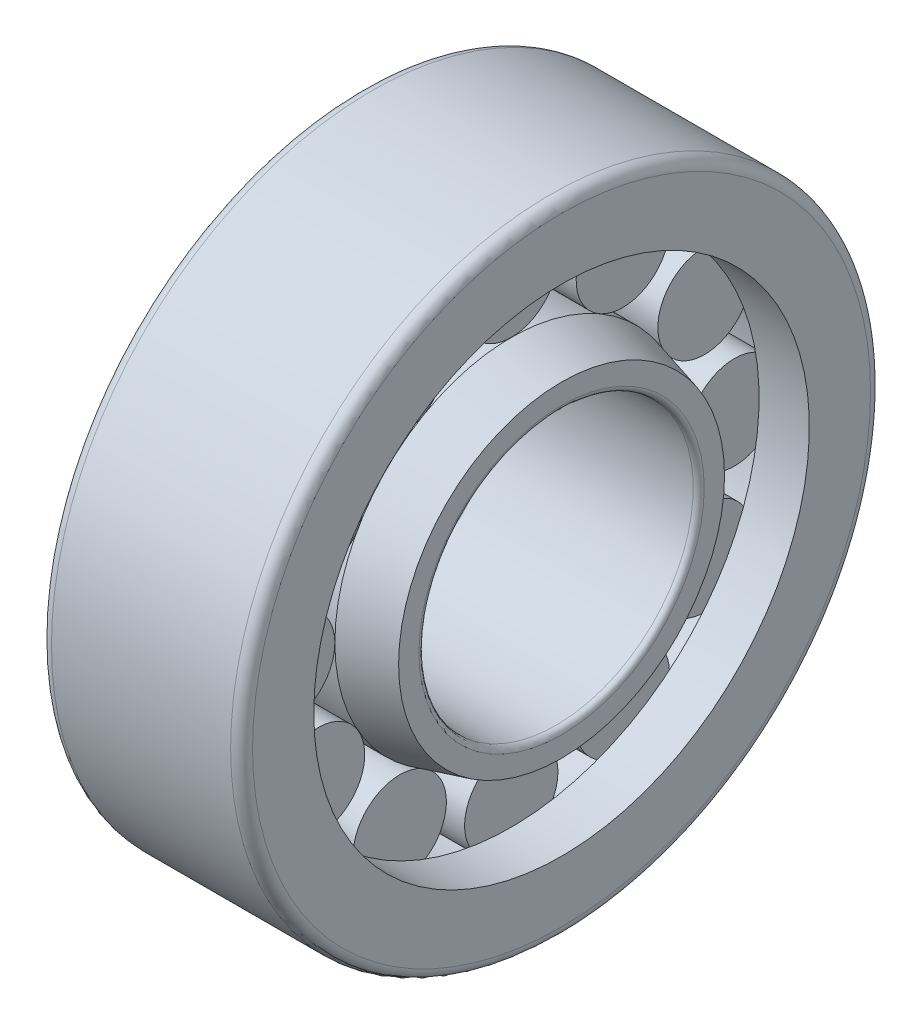
from build123d import *

# Parameters (mm, degrees)
SKETCH_3_W               = 5.5
SKETCH_3_H               = 2.55125
PATTERN_CIRCULAR_1_COUNT = 12


with BuildPart() as part:
    # 草图2 → Revolve 600 (revolve)
    with BuildSketch(Plane.XY):
        with BuildLine():
            Line((2.75, 9.65), (8.25, 9.65))
            Line((8.25, 9.65), (11, 8.913139721))
            Line((11, 8.913139721), (11, 7.8))
            ThreePointArc((11, 7.8), (10.912132034, 7.587867966), (10.7, 7.5))
            Line((10.7, 7.5), (0.3, 7.5))
            ThreePointArc((0.3, 7.5), (0.087867966, 7.587867966), (0, 7.8))
            Line((0, 7.8), (0, 10.25))
            Line((0, 10.25), (2.75, 10.25))
            Line((2.75, 10.25), (2.75, 9.65))
        make_face()
    revolve(axis=Axis((-10.080094127, 0, 0), (1, 0, 0)))


with BuildPart() as body_2:
    # 草图4 → 凸台-旋转2 (revolve)
    with BuildSketch(Plane.XY):
        with BuildLine():
            Line((8.25, 13.5525), (11, 13.5525))
            Line((11, 13.5525), (11, 16.9))
            ThreePointArc((11, 16.9), (10.824264069, 17.324264069), (10.4, 17.5))
            Line((10.4, 17.5), (0.6, 17.5))
            ThreePointArc((0.6, 17.5), (0.175735931, 17.324264069), (0, 16.9))
            Line((0, 16.9), (0, 13.5525))
            Line((0, 13.5525), (2.75, 13.5525))
            Line((2.75, 13.5525), (2.75, 14.7525))
            Line((2.75, 14.7525), (8.25, 14.7525))
            Line((8.25, 14.7525), (8.25, 13.5525))
        make_face()
    revolve(axis=Axis((0, 0, 0), (1, 0, 0)))


with BuildPart() as body_3:
    # 草图3 → 凸台-旋转1 (revolve)
    with BuildSketch(Plane.XY):
        with Locations((5.5, 13.476875)):
            Rectangle(SKETCH_3_W, SKETCH_3_H)
    revolve(axis=Axis((2.75, 12.20125, 0), (1, 0, 0)))


with BuildPart() as pattern_circular_1_1:
    # 阵列(圆周)1: pattern copy
    add(body_3.part.rotate(Axis((-80.9, 0, 0), (1, 0, 0)), 1 * 360 / PATTERN_CIRCULAR_1_COUNT))


with BuildPart() as pattern_circular_1_2:
    # 阵列(圆周)1: pattern copy
    add(body_3.part.rotate(Axis((-80.9, 0, 0), (1, 0, 0)), 2 * 360 / PATTERN_CIRCULAR_1_COUNT))


with BuildPart() as pattern_circular_1_3:
    # 阵列(圆周)1: pattern copy
    add(body_3.part.rotate(Axis((-80.9, 0, 0), (1, 0, 0)), 3 * 360 / PATTERN_CIRCULAR_1_COUNT))


with BuildPart() as pattern_circular_1_4:
    # 阵列(圆周)1: pattern copy
    add(body_3.part.rotate(Axis((-80.9, 0, 0), (1, 0, 0)), 4 * 360 / PATTERN_CIRCULAR_1_COUNT))


with BuildPart() as pattern_circular_1_5:
    # 阵列(圆周)1: pattern copy
    add(body_3.part.rotate(Axis((-80.9, 0, 0), (1, 0, 0)), 5 * 360 / PATTERN_CIRCULAR_1_COUNT))


with BuildPart() as pattern_circular_1_6:
    # 阵列(圆周)1: pattern copy
    add(body_3.part.rotate(Axis((-80.9, 0, 0), (1, 0, 0)), 6 * 360 / PATTERN_CIRCULAR_1_COUNT))


with BuildPart() as pattern_circular_1_7:
    # 阵列(圆周)1: pattern copy
    add(body_3.part.rotate(Axis((-80.9, 0, 0), (1, 0, 0)), 7 * 360 / PATTERN_CIRCULAR_1_COUNT))


with BuildPart() as pattern_circular_1_8:
    # 阵列(圆周)1: pattern copy
    add(body_3.part.rotate(Axis((-80.9, 0, 0), (1, 0, 0)), 8 * 360 / PATTERN_CIRCULAR_1_COUNT))


with BuildPart() as pattern_circular_1_9:
    # 阵列(圆周)1: pattern copy
    add(body_3.part.rotate(Axis((-80.9, 0, 0), (1, 0, 0)), 9 * 360 / PATTERN_CIRCULAR_1_COUNT))


with BuildPart() as pattern_circular_1_10:
    # 阵列(圆周)1: pattern copy
    add(body_3.part.rotate(Axis((-80.9, 0, 0), (1, 0, 0)), 10 * 360 / PATTERN_CIRCULAR_1_COUNT))


with BuildPart() as pattern_circular_1_11:
    # 阵列(圆周)1: pattern copy
    add(body_3.part.rotate(Axis((-80.9, 0, 0), (1, 0, 0)), 11 * 360 / PATTERN_CIRCULAR_1_COUNT))


solid = Compound([part.part, body_2.part, body_3.part, pattern_circular_1_1.part, pattern_circular_1_2.part, pattern_circular_1_3.part, pattern_circular_1_4.part, pattern_circular_1_5.part, pattern_circular_1_6.part, pattern_circular_1_7.part, pattern_circular_1_8.part, pattern_circular_1_9.part, pattern_circular_1_10.part, pattern_circular_1_11.part])
